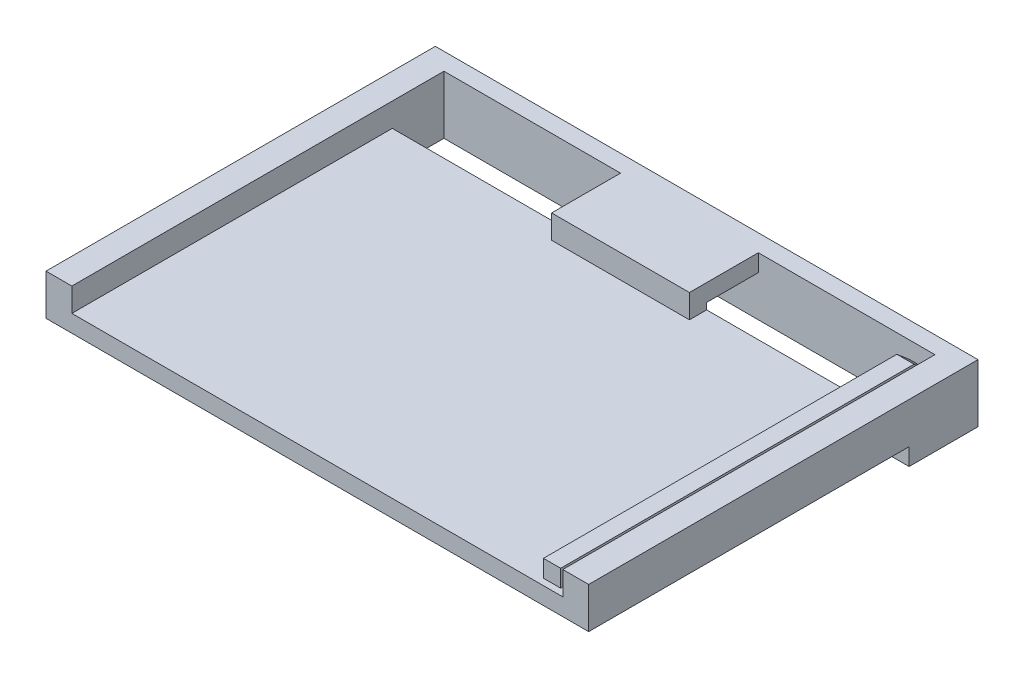
from build123d import *

# Parameters (mm, degrees)
SKETCH1_W           = 63
SKETCH1_H           = 45.2
BOSS_EXTRUDE1_DEPTH = 6.75
SKETCH2_W           = 63
SKETCH2_H           = 37.2
CUT_EXTRUDE1_DEPTH  = 2
CUT_EXTRUDE2_DEPTH  = 2.75
SKETCH4_W           = 20.5
SKETCH4_H           = 6
CUT_EXTRUDE3_DEPTH  = 40.351905926
SKETCH5_W           = 16
SKETCH5_H           = 6
CUT_EXTRUDE4_DEPTH  = 4.75
CUT_EXTRUDE5_DEPTH  = 1
BOSS_EXTRUDE2_START = 0.5
SKETCH7_R           = 1
BOSS_EXTRUDE2_DEPTH = 0.75
BOSS_EXTRUDE3_DEPTH = 2
CUT_EXTRUDE6_DEPTH  = 39.974478829


with BuildPart() as part:
    # Sketch1 → Boss-Extrude1 (new body)
    with BuildSketch(Plane(origin=(0, 0, 0), x_dir=(1, 0, 0), z_dir=(0, 1, 0))):
        Rectangle(SKETCH1_W, SKETCH1_H)
    extrude(amount=BOSS_EXTRUDE1_DEPTH)

    # Sketch2 → Cut-Extrude1 (cut)
    with BuildSketch(Plane.XZ):
        with Locations((0, 4)):
            Rectangle(SKETCH2_W, SKETCH2_H)
    extrude(amount=-CUT_EXTRUDE1_DEPTH, mode=Mode.SUBTRACT)

    # Sketch3 → Cut-Extrude2 (cut)
    with BuildSketch(Plane(origin=(0, 6.75, 0), x_dir=(1, 0, 0), z_dir=(0, 1, 0))):
        Polygon((-28.5, 20.6), (-8, 20.6), (-8, 12.6), (8, 12.6), (8, 20.6), (28.5, 20.6), (28.5, -22.6), (-28.5, -22.6), align=None)
    extrude(amount=-CUT_EXTRUDE2_DEPTH, mode=Mode.SUBTRACT)

    # Sketch4 → Cut-Extrude3 (cut, through all)
    with BuildSketch(Plane.XZ):
        with Locations((-18.25, -17.6)):
            Rectangle(SKETCH4_W, SKETCH4_H)
        with Locations((18.25, -17.6)):
            Rectangle(SKETCH4_W, SKETCH4_H)
    extrude(amount=-CUT_EXTRUDE3_DEPTH, mode=Mode.SUBTRACT)

    # Sketch5 → Cut-Extrude4 (cut)
    with BuildSketch(Plane.XZ):
        with Locations((0, -17.6)):
            Rectangle(SKETCH5_W, SKETCH5_H)
    extrude(amount=-CUT_EXTRUDE4_DEPTH, mode=Mode.SUBTRACT)

    # Sketch6 → Cut-Extrude5 (cut)
    with BuildSketch(Plane.ZY.offset(-28.5)):
        with BuildLine():
            Line((-20.351063048, 4.75), (-20.6, 0))
            Line((-20.6, 0), (-17.852126097, 0))
            Line((-17.852126097, 0), (-18.101063048, 4.75))
            ThreePointArc((-18.101063048, 4.75), (-19.226063048, 5.875), (-20.351063048, 4.75))
        make_face()
    extrude(amount=-CUT_EXTRUDE5_DEPTH, mode=Mode.SUBTRACT)

    # Sketch9 → Cut-Extrude6 (cut, through all)
    with BuildSketch(Plane(origin=(0, 4, 0), x_dir=(1, 0, 0), z_dir=(0, 1, 0))):
        Polygon((8, 20.6), (28.5, 20.6), (28.5, 12.6), (24.5, 12.6), (24.5, 14.6), (8, 14.6), align=None)
    extrude(amount=-CUT_EXTRUDE6_DEPTH, mode=Mode.SUBTRACT)


with BuildPart() as body_2:
    # Sketch7 → Boss-Extrude2 (new body)
    with BuildSketch(Plane.ZY.offset(-29.5).offset(BOSS_EXTRUDE2_START)):
        with Locations((-19.226063048, 4.75)):
            Circle(SKETCH7_R)
    extrude(amount=BOSS_EXTRUDE2_DEPTH)

    # Sketch8 → Boss-Extrude3 (add)
    with BuildSketch(Plane.ZY.offset(-28.25)):
        with BuildLine():
            Line((-19.876707821, 5.509382235), (-18.428754759, 6.75))
            Line((-18.428754759, 6.75), (22.6, 6.75))
            Line((22.6, 6.75), (22.6, 4.75))
            Line((22.6, 4.75), (-17.689126087, 4.75))
            Line((-17.689126087, 4.75), (-18.575418276, 3.990617765))
            ThreePointArc((-18.575418276, 3.990617765), (-19.985445284, 4.099355227), (-19.876707821, 5.509382235))
        make_face()
    extrude(amount=BOSS_EXTRUDE3_DEPTH)


solid = Compound([part.part, body_2.part])
